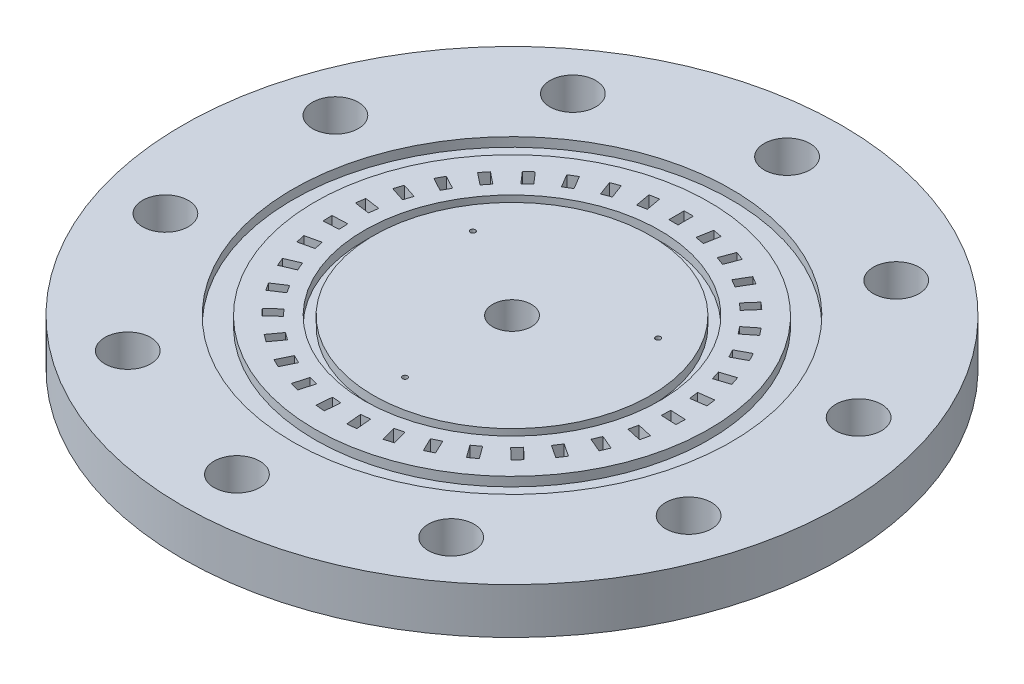
from build123d import *

# Parameters (mm, degrees)
SKETCH1_R                       = 107.826846
SKETCH1_R_2                     = 7.5
SKETCH1_R_3                     = 6.35
FACEPLATE_EXTRUSION_DEPTH       = 15
REGEN_CHANNELS_W                = 3
REGEN_CHANNELS_H                = 5
REGEN_CHANNEL_DEPTH             = 154.226164334
REGEN_CHANNELS_REVOLVE_COUNT    = 35
SKETCH30_R                      = 71.686846
SKETCH30_R_2                    = 64.447846
INTERFACING_O_RING_SLOT_1_DEPTH = 3
INTERFACING_START               = -3
SKETCH32_R                      = 71.687
SKETCH32_R_2                    = 64.447846
INTERFACING_O_RING_SLOT_2_DEPTH = 3
SKETCH33_R                      = 48.33
SKETCH33_R_2                    = 45.33
MANIFOLD_O_RING_SLOT_1_DEPTH    = 3
MANIFOLD_START                  = -3
SKETCH34_R                      = 48.33
SKETCH34_R_2                    = 45.33
MANIFOLD_O_RING_SLOT_2_DEPTH    = 3
SKETCH35_R                      = 0.8262
FUEL_BYPASS_CHANNELS_DEPTH      = 154.226164334


with BuildPart() as part:
    # Sketch1 → Faceplate Extrusion (new body)
    with BuildSketch(Plane(origin=(0, 0, 0), x_dir=(1, 0, 0), z_dir=(0, 1, 0))):
        with Locations(Location((0, 0, 0), (0, 0, 270))):
            Circle(SKETCH1_R)
        with Locations(Location((0, 90, 0), (0, 0, 270))):
            Circle(SKETCH1_R_2, mode=Mode.SUBTRACT)
        with Locations(Location((52.900672706, 72.811529494, 0), (0, 0, 270))):
            Circle(SKETCH1_R_2, mode=Mode.SUBTRACT)
        with Locations(Location((85.595086467, 27.811529494, 0), (0, 0, 270))):
            Circle(SKETCH1_R_2, mode=Mode.SUBTRACT)
        with Locations(Location((85.595086467, -27.811529494, 0), (0, 0, 270))):
            Circle(SKETCH1_R_2, mode=Mode.SUBTRACT)
        with Locations(Location((52.900672706, -72.811529494, 0), (0, 0, 270))):
            Circle(SKETCH1_R_2, mode=Mode.SUBTRACT)
        with Locations(Location((0, -90, 0), (0, 0, 270))):
            Circle(SKETCH1_R_2, mode=Mode.SUBTRACT)
        with Locations(Location((-52.900672706, -72.811529494, 0), (0, 0, 270))):
            Circle(SKETCH1_R_2, mode=Mode.SUBTRACT)
        with Locations(Location((-85.595086467, -27.811529494, 0), (0, 0, 270))):
            Circle(SKETCH1_R_2, mode=Mode.SUBTRACT)
        with Locations(Location((-85.595086467, 27.811529494, 0), (0, 0, 270))):
            Circle(SKETCH1_R_2, mode=Mode.SUBTRACT)
        with Locations(Location((-52.900672706, 72.811529494, 0), (0, 0, 270))):
            Circle(SKETCH1_R_2, mode=Mode.SUBTRACT)
        with Locations(Location((0, 0, 0), (0, 0, 270))):
            Circle(SKETCH1_R_3, mode=Mode.SUBTRACT)
    extrude(amount=FACEPLATE_EXTRUSION_DEPTH)

    # Regen Channels → Regen Channel (cut, through all)
    with BuildSketch(Plane(origin=(0, 15, 0), x_dir=(1, 0, 0), z_dir=(0, 1, 0))):
        with Locations((0, 55.326846)):
            Rectangle(REGEN_CHANNELS_W, REGEN_CHANNELS_H)
    regen_channel = extrude(amount=-REGEN_CHANNEL_DEPTH, mode=Mode.SUBTRACT)

    # Regen Channels Revolve: Regen Channel ×35 about axis
    regen_channels_revolve_axis = Axis((0, 0, 0), (0, 1, 0))
    for i in range(1, REGEN_CHANNELS_REVOLVE_COUNT):
        add(regen_channel.rotate(regen_channels_revolve_axis, i * 360 / REGEN_CHANNELS_REVOLVE_COUNT), mode=Mode.SUBTRACT)

    # Sketch30 → Interfacing O-Ring Slot 1 (cut)
    with BuildSketch(Plane.XZ):
        with Locations(Location((0, 0, 0), (0, 0, 270))):
            Circle(SKETCH30_R)
        with Locations(Location((0, 0, 0), (0, 0, 270))):
            Circle(SKETCH30_R_2, mode=Mode.SUBTRACT)
    extrude(amount=-INTERFACING_O_RING_SLOT_1_DEPTH, mode=Mode.SUBTRACT)

    # Sketch32 → Interfacing O-Ring Slot 2 (cut)
    with BuildSketch(Plane(origin=(0, 15, 0), x_dir=(1, 0, 0), z_dir=(0, 1, 0)).offset(INTERFACING_START)):
        with Locations(Location((0, 0, 0), (0, 0, 270))):
            Circle(SKETCH32_R)
        with Locations(Location((0, 0, 0), (0, 0, 90))):
            Circle(SKETCH32_R_2, mode=Mode.SUBTRACT)
    extrude(amount=INTERFACING_O_RING_SLOT_2_DEPTH, mode=Mode.SUBTRACT)

    # Sketch33 → Manifold O-Ring Slot 1 (cut)
    with BuildSketch(Plane(origin=(0, 15, 0), x_dir=(1, 0, 0), z_dir=(0, 1, 0))):
        with Locations(Location((0, 0, 0), (0, 0, 270))):
            Circle(SKETCH33_R)
        with Locations(Location((0, 0, 0), (0, 0, 270))):
            Circle(SKETCH33_R_2, mode=Mode.SUBTRACT)
    extrude(amount=-MANIFOLD_O_RING_SLOT_1_DEPTH, mode=Mode.SUBTRACT)

    # Sketch34 → Manifold O-Ring Slot 2 (cut)
    with BuildSketch(Plane.XZ.offset(MANIFOLD_START)):
        with Locations(Location((0, 0, 0), (0, 0, 90))):
            Circle(SKETCH34_R)
        with Locations(Location((0, 0, 0), (0, 0, 90))):
            Circle(SKETCH34_R_2, mode=Mode.SUBTRACT)
    extrude(amount=MANIFOLD_O_RING_SLOT_2_DEPTH, mode=Mode.SUBTRACT)

    # Sketch35 → Fuel Bypass Channels (cut, through all)
    with BuildSketch(Plane.XZ):
        with Locations(Location((0, 35, 0), (0, 0, 270))):
            Circle(SKETCH35_R)
        with Locations(Location((30.310889132, -17.5, 0), (0, 0, 270))):
            Circle(SKETCH35_R)
        with Locations(Location((-30.310889132, -17.5, 0), (0, 0, 270))):
            Circle(SKETCH35_R)
    extrude(amount=-FUEL_BYPASS_CHANNELS_DEPTH, mode=Mode.SUBTRACT)


solid = part.part
